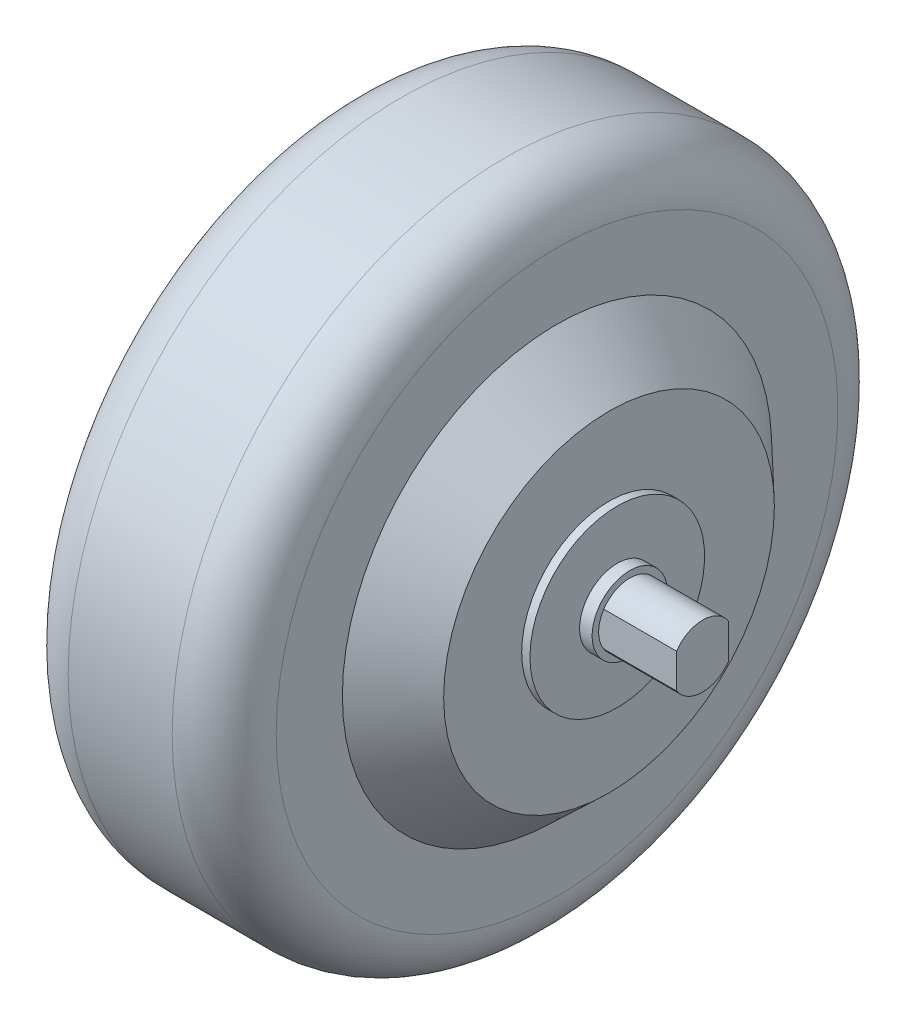
from build123d import *

# Parameters (mm, degrees)
CUT_EXTRUDE1_START = -96
CUT_EXTRUDE1_DEPTH = 96


with BuildPart() as part:
    # Sketch2 → Revolve1 (revolve)
    with BuildSketch(Plane.XY, mode=Mode.PRIVATE) as revolve1_sk:
        with BuildLine():
            Line((10, 64), (-10, 64))
            ThreePointArc((-10, 64), (-17.071067812, 61.071067812), (-20, 54))
            Line((-20, 54), (-20, 41.275))
            Line((-20, 41.275), (-30, 31.795))
            Line((-30, 31.795), (-30, 16.795))
            Line((-30, 16.795), (-31.5875, 16.795))
            Line((-31.5875, 16.795), (-31.5875, 7.25))
            Line((-31.5875, 7.25), (-34, 7.25))
            Line((-34, 7.25), (-34, 6))
            Line((-34, 6), (-48, 6))
            Line((-48, 6), (-48, 0))
            Line((-48, 0), (48, 0))
            Line((48, 0), (48, 6))
            Line((48, 6), (34, 6))
            Line((34, 6), (34, 7.25))
            Line((34, 7.25), (31.5875, 7.25))
            Line((31.5875, 7.25), (31.5875, 16.795))
            Line((31.5875, 16.795), (30, 16.795))
            Line((30, 16.795), (30, 31.795))
            Line((30, 31.795), (20, 41.275))
            Line((20, 41.275), (20, 54))
            ThreePointArc((20, 54), (17.071067812, 61.071067812), (10, 64))
        make_face()
    revolve(revolve1_sk.sketch.rotate(Axis((-48, 0, 0), (1, 0, 0)), 90), axis=Axis((-48, 0, 0), (1, 0, 0)))

    # Sketch3 → Cut-Extrude1 (cut)
    with BuildSketch(Plane.ZY.offset(48).offset(CUT_EXTRUDE1_START)):
        with BuildLine():
            Line((5, 3.31662479), (5, -3.31662479))
            ThreePointArc((5, -3.31662479), (6, 0), (5, 3.31662479))
        make_face()
        with BuildLine():
            Line((-5, 3.31662479), (-5, -3.31662479))
            ThreePointArc((-5, -3.31662479), (-6, 0), (-5, 3.31662479))
        make_face()
    cut_extrude1 = extrude(amount=CUT_EXTRUDE1_DEPTH, mode=Mode.SUBTRACT)

    # Mirror1: Cut-Extrude1 across plane
    add(cut_extrude1.mirror(Plane(origin=(0, 0, 0), x_dir=(0, 0, 1), z_dir=(1, 0, 0))), mode=Mode.SUBTRACT)


solid = part.part
